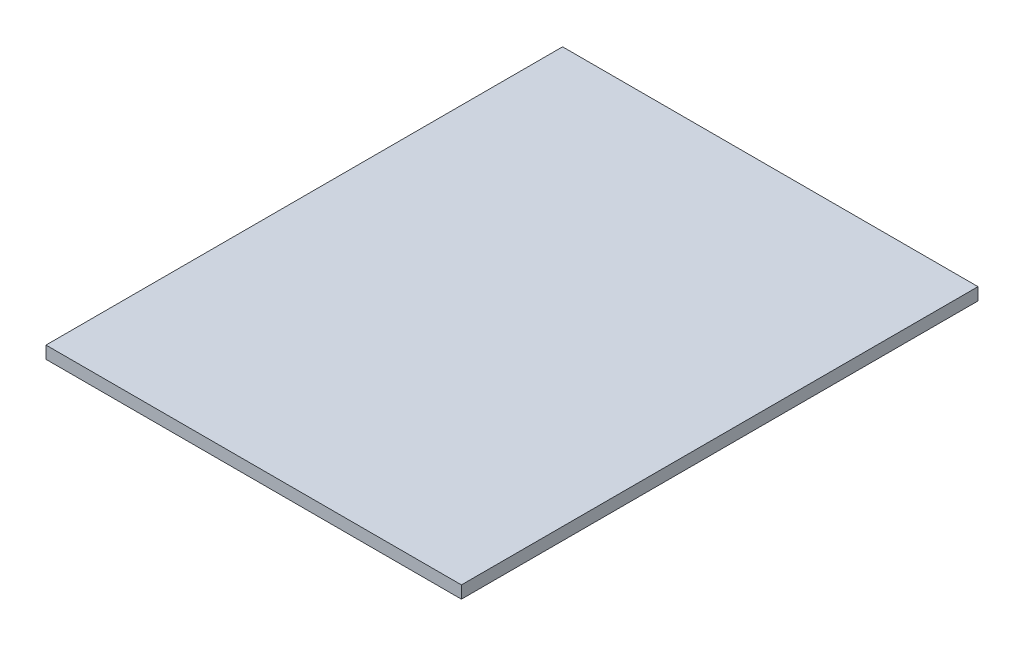
from build123d import *

# Parameters (mm, degrees)
SKETCH1_W           = 612.775
SKETCH1_H           = 762
BOSS_EXTRUDE1_DEPTH = 18.288


with BuildPart() as part:
    # Sketch1 → Boss-Extrude1 (new body)
    with BuildSketch(Plane(origin=(0, 0, 0), x_dir=(1, 0, 0), z_dir=(0, 1, 0))):
        Rectangle(SKETCH1_W, SKETCH1_H)
    extrude(amount=BOSS_EXTRUDE1_DEPTH)


solid = part.part
